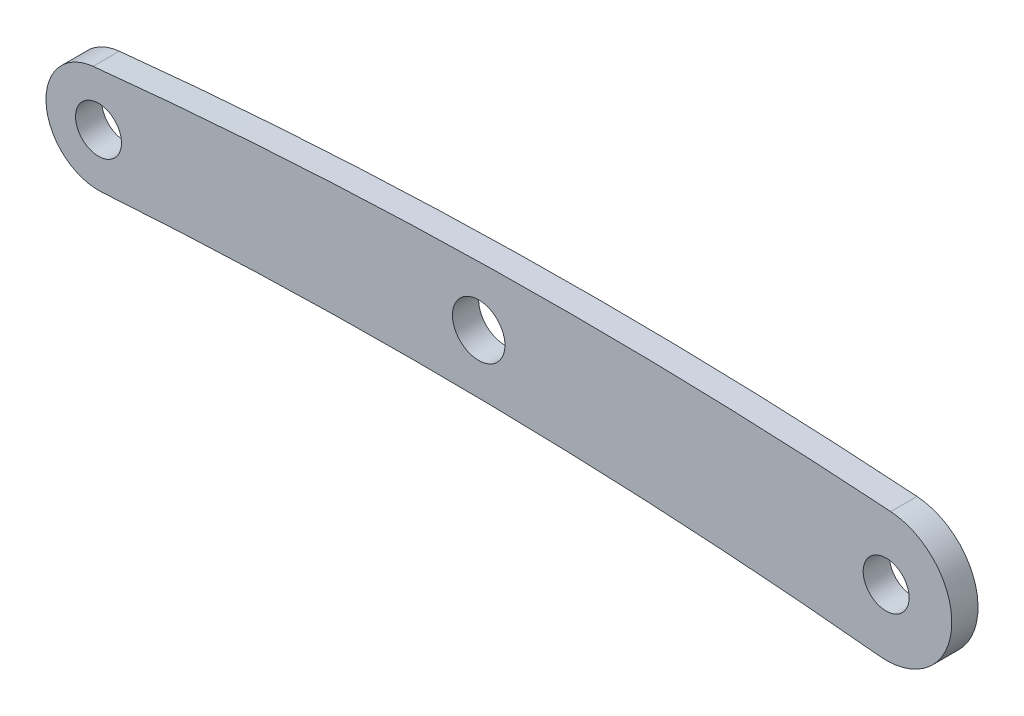
from build123d import *

# Parameters (mm, degrees)
SKETCH1_R           = 1.75
BOSS_EXTRUDE1_DEPTH = 2
SKETCH_1_R          = 2
CUT_EXTRUDE_1_DEPTH = 10


with BuildPart() as part:
    # Sketch1 → Boss-Extrude1 (new body)
    with BuildSketch(Plane.XY):
        with BuildLine():
            ThreePointArc((-0.413391137, 3.978581125), (-3.985278749, -0.34286046), (0.272222222, -3.990726132))
            ThreePointArc((0.272222222, -3.990726132), (29.90408025, -3.227529096), (59.494248826, -4.974355813))
            ThreePointArc((59.494248826, -4.974355813), (64.981597081, -0.428591321), (60.351328502, 4.987641555))
            ThreePointArc((60.351328502, 4.987641555), (29.947025925, 5.804484659), (-0.413391137, 3.978581125))
        make_face()
        Circle(SKETCH1_R, mode=Mode.SUBTRACT)
        with Locations((60, 0)):
            Circle(SKETCH1_R, mode=Mode.SUBTRACT)
    extrude(amount=BOSS_EXTRUDE1_DEPTH)

    # 草图1 → 切除-拉伸1 (cut)
    with BuildSketch(Plane.XY.offset(2)):
        with Locations((28.961050448, 1.261749932)):
            Circle(SKETCH_1_R)
    extrude(amount=-CUT_EXTRUDE_1_DEPTH, mode=Mode.SUBTRACT)


solid = part.part
